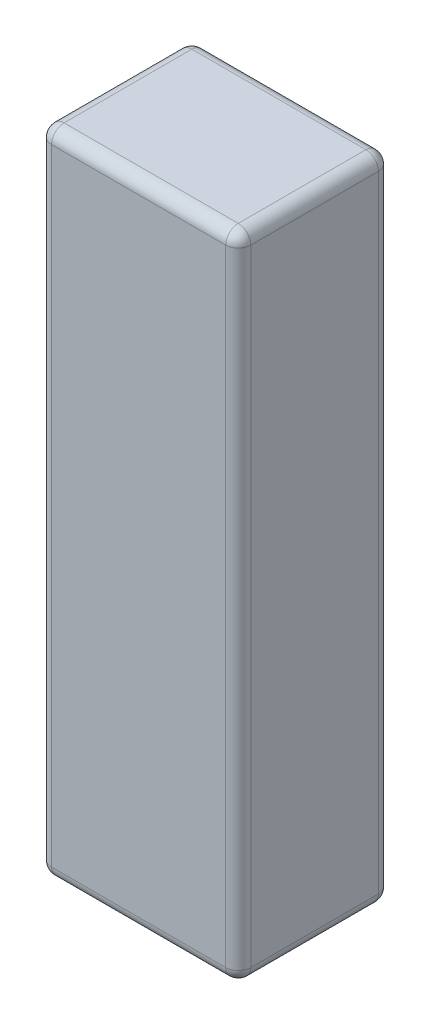
from build123d import *

# Parameters (mm, degrees)
SKETCH1_W           = 19.05
SKETCH1_H           = 62.23
BOSS_EXTRUDE1_DEPTH = 14.605
FILLET1_R           = 1.2


with BuildPart() as part:
    # Sketch1 → Boss-Extrude1 (new body)
    with BuildSketch(Plane.XY):
        Rectangle(SKETCH1_W, SKETCH1_H)
    extrude(amount=BOSS_EXTRUDE1_DEPTH)

    # Fillet1
    fillet1_edges = [part.edges().sort_by_distance(p)[0] for p in [
        (-9.525, 0, 14.605),
        (0, -31.115, 14.605),
        (9.525, 0, 14.605),
        (0, -31.115, 0),
        (-9.525, 0, 0),
        (0, 31.115, 0),
        (9.525, 0, 0),
        (9.525, -31.115, 7.3025),
        (-9.525, -31.115, 7.3025),
        (-9.525, 31.115, 7.3025),
        (9.525, 31.115, 7.3025),
        (0, 31.115, 14.605),
    ]]
    fillet(fillet1_edges, radius=FILLET1_R)


solid = part.part
